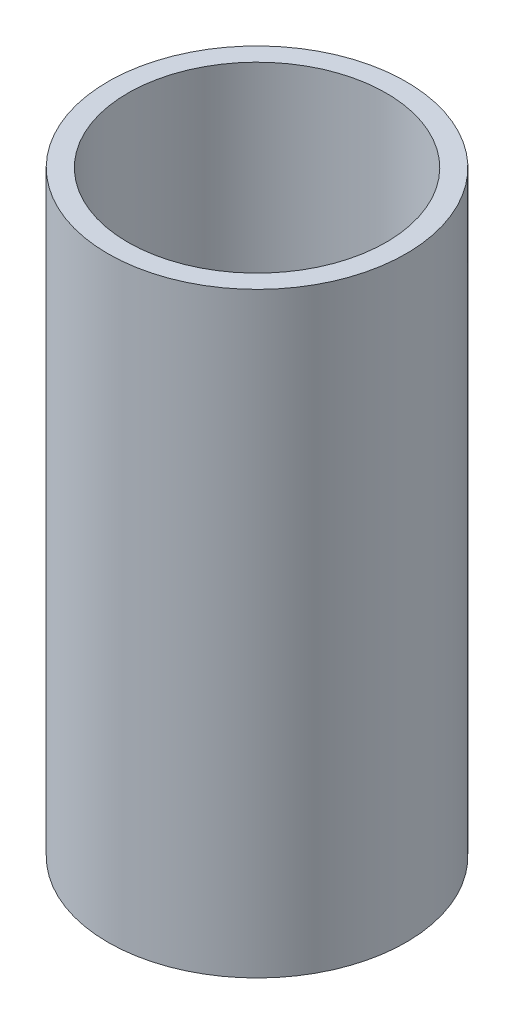
from build123d import *

# Parameters (mm, degrees)
SKETCH1_R           = 30
SKETCH1_R_2         = 26
BOSS_EXTRUDE1_DEPTH = 60


with BuildPart() as part:
    # Sketch1 → Boss-Extrude1 (new, symmetric)
    with BuildSketch(Plane(origin=(0, 0, 0), x_dir=(1, 0, 0), z_dir=(0, 1, 0))):
        with Locations(Location((0, 0, 0), (0, 0, 270))):
            Circle(SKETCH1_R)
        with Locations(Location((0, 0, 0), (0, 0, 270))):
            Circle(SKETCH1_R_2, mode=Mode.SUBTRACT)
    extrude(amount=BOSS_EXTRUDE1_DEPTH, both=True)


solid = part.part
